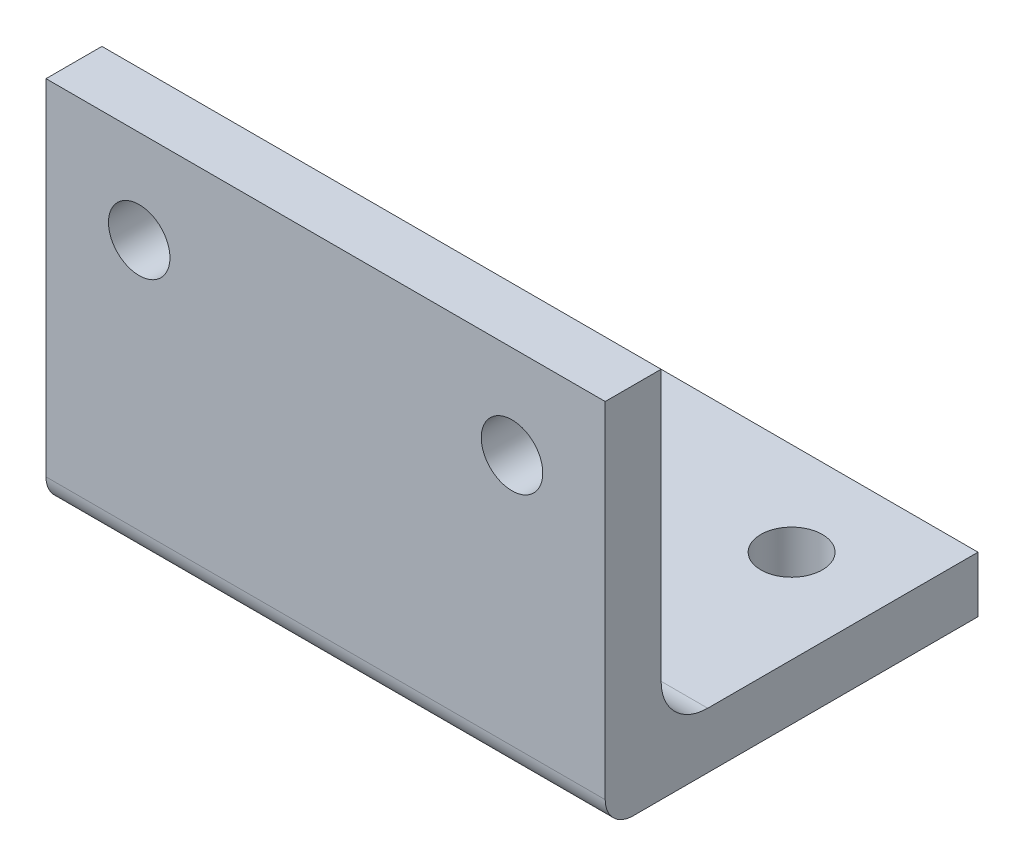
from build123d import *

# Parameters (mm, degrees)
EXTRUDE_1_DEPTH     = 60
SKETCH_2_R          = 3.3
CUT_EXTRUDE_1_DEPTH = 83.462112512
SKETCH_3_R          = 3.3
CUT_EXTRUDE_2_DEPTH = 83.462112512
FILLET_1_R          = 5
FILLET_2_R          = 3


with BuildPart() as part:
    # 草圖1 → 填料-伸長1 (new body)
    with BuildSketch(Plane(origin=(0, 0, 0), x_dir=(0, 0, -1), z_dir=(1, 0, 0))):
        Polygon((0, 0), (40, 0), (40, 6), (6, 6), (6, 40), (0, 40), align=None)
    extrude(amount=EXTRUDE_1_DEPTH)

    # 草圖2 → 除料-伸長1 (cut, through all)
    with BuildSketch(Plane(origin=(0, 0, 0), x_dir=(1, 0, 0), z_dir=(0, 1, 0))):
        with Locations(Location((10, 30, 0), (0, 0, 90))):
            Circle(SKETCH_2_R)
        with Locations(Location((50, 30, 0), (0, 0, 90))):
            Circle(SKETCH_2_R)
    extrude(amount=CUT_EXTRUDE_1_DEPTH, mode=Mode.SUBTRACT)

    # 草圖3 → 除料-伸長2 (cut, through all)
    with BuildSketch(Plane.XY):
        with Locations((10, 30)):
            Circle(SKETCH_3_R)
        with Locations((50, 30)):
            Circle(SKETCH_3_R)
    extrude(amount=-CUT_EXTRUDE_2_DEPTH, mode=Mode.SUBTRACT)

    # 圓角1
    fillet_1_edges = [part.edges().sort_by_distance(p)[0] for p in [
        (30, 6, -6),
    ]]
    fillet(fillet_1_edges, radius=FILLET_1_R)

    # 圓角2
    fillet_2_edges = [part.edges().sort_by_distance(p)[0] for p in [
        (30, 0, 0),
    ]]
    fillet(fillet_2_edges, radius=FILLET_2_R)


solid = part.part
